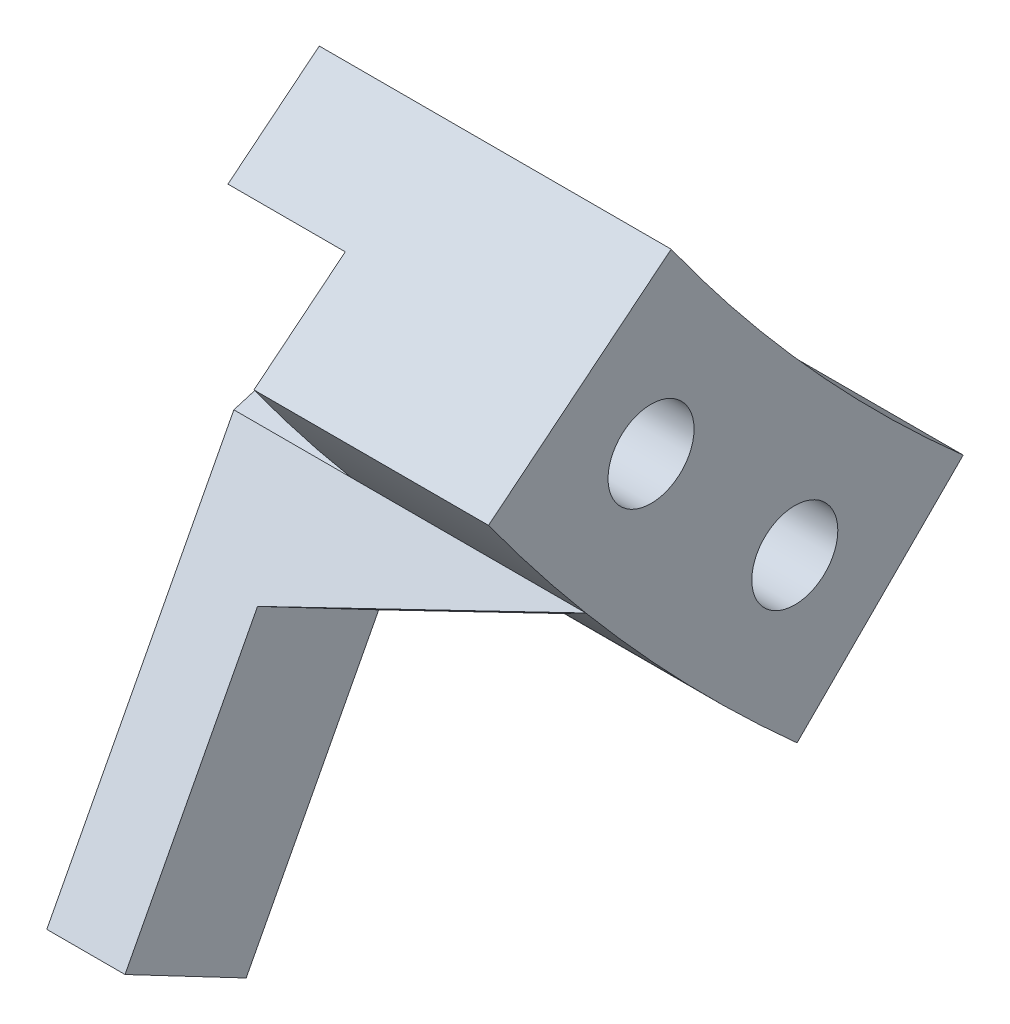
from build123d import *

# Parameters (mm, degrees)
SKETCH_1_R          = 1.1
EXTRUDE_1_DEPTH     = 9
EXTRUDE_2_DEPTH     = 2
EXTRUDE_3_DEPTH     = 3.5
CUT_EXTRUDE_1_DEPTH = 3


with BuildPart() as part:
    # 草图1 → 凸台-拉伸1 (new body)
    with BuildSketch(Plane(origin=(0, 0, 0), x_dir=(0, 0, -1), z_dir=(1, 0, 0))):
        with BuildLine():
            Line((-44.956504104, -32.544780514), (-40.285971637, -28.762657896))
            ThreePointArc((-40.285971637, -28.762657896), (-36.785668861, -33.121965015), (-32.816123753, -37.05876444))
            Line((-32.816123753, -37.05876444), (-37.065731089, -41.308371776))
            ThreePointArc((-37.065731089, -41.308371776), (-41.244537814, -37.136748653), (-44.956504104, -32.544780514))
        make_face()
        with Locations((-40.800162976, -33.03932053)):
            Circle(SKETCH_1_R, mode=Mode.SUBTRACT)
        with Locations((-37.123106012, -37.123106012)):
            Circle(SKETCH_1_R, mode=Mode.SUBTRACT)
    extrude(amount=EXTRUDE_1_DEPTH)

    # 草图2 → 凸台-拉伸2 (add)
    with BuildSketch(Plane.ZY):
        with BuildLine():
            Line((42.469798969, -35.729066257), (47.254371389, -44.844869924))
            Line((47.254371389, -44.844869924), (44.155307417, -46.47146222))
            Line((44.155307417, -46.47146222), (39.972641515, -38.502440576))
            ThreePointArc((39.972641515, -38.502440576), (41.244537814, -37.136748653), (42.469798969, -35.729066257))
        make_face()
    extrude(amount=-EXTRUDE_2_DEPTH)

    # 草图3 → 凸台-拉伸3 (add)
    with BuildSketch(Plane(origin=(0, 9.759553772, 18.594383834), x_dir=(1, 0, 0), z_dir=(0, 0.4647406558327103, 0.8854468492327375))):
        Polygon((2, -51.373631369), (2, -54.373631369), (9, -51.373631369), align=None)
    extrude(amount=-EXTRUDE_3_DEPTH)

    # 草图4 → 切除-拉伸1 (cut)
    with BuildSketch(Plane.ZY):
        with BuildLine():
            Line((40.800162976, -30.93932053), (42.621237871, -30.653719205))
            Line((42.621237871, -30.653719205), (44.956504104, -32.544780514))
            ThreePointArc((44.956504104, -32.544780514), (43.74213685, -34.159558894), (42.469798969, -35.729066257))
            Line((42.469798969, -35.729066257), (40.199666496, -35.051633621))
            ThreePointArc((40.199666496, -35.051633621), (38.722200333, -32.735888076), (40.800162976, -30.93932053))
        make_face()
        with BuildLine():
            Line((34.940927421, -39.183568108), (35.023106012, -37.123106012))
            ThreePointArc((35.023106012, -37.123106012), (36.71133724, -35.063871573), (39.061626467, -36.315555119))
            Line((39.061626467, -36.315555119), (39.972641515, -38.502440576))
            ThreePointArc((39.972641515, -38.502440576), (38.544727601, -39.93186665), (37.065731089, -41.308371776))
            Line((37.065731089, -41.308371776), (34.940927421, -39.183568108))
        make_face()
    extrude(amount=-CUT_EXTRUDE_1_DEPTH, mode=Mode.SUBTRACT)


solid = part.part
